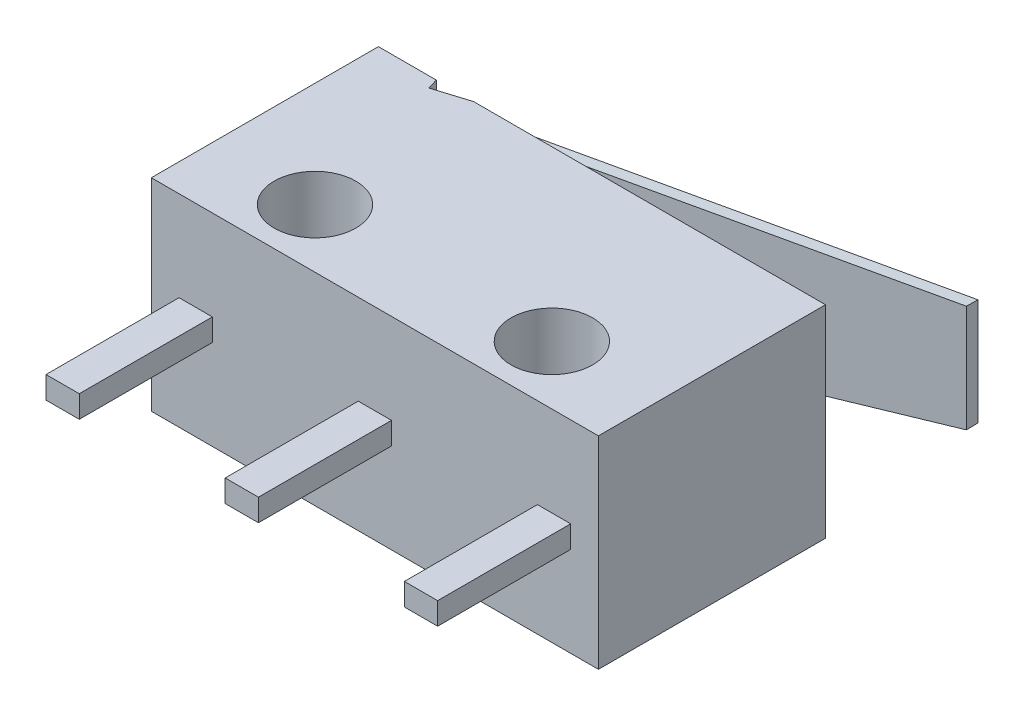
from build123d import *

# Parameters (mm, degrees)
SKETCH1_W           = 12.8016
SKETCH1_H           = 6.5024
SKETCH1_R           = 1.1684
BOSS_EXTRUDE1_DEPTH = 5.7912
SKETCH2_W           = 1.016
SKETCH2_H           = 3.556
BOSS_EXTRUDE2_DEPTH = 1.27
CUT_EXTRUDE1_DEPTH  = 4.318
BOSS_EXTRUDE6_DEPTH = 5.7912
CUT_EXTRUDE2_DEPTH  = 0.3175
SKETCH7_W           = 0.9525
SKETCH7_H           = 0.635
BOSS_EXTRUDE7_DEPTH = 3.81


with BuildPart() as part:
    # Sketch1 → Boss-Extrude1 (new body)
    with BuildSketch(Plane(origin=(0, 0, 0), x_dir=(1, 0, 0), z_dir=(0, 1, 0))):
        Rectangle(SKETCH1_W, SKETCH1_H)
        with Locations(Location((3.3909, -1.5748, 0), (0, 0, 270))):
            Circle(SKETCH1_R, mode=Mode.SUBTRACT)
        with Locations(Location((-3.3909, -1.5748, 0), (0, 0, 90))):
            Circle(SKETCH1_R, mode=Mode.SUBTRACT)
    extrude(amount=BOSS_EXTRUDE1_DEPTH)

    # Sketch2 → Boss-Extrude2 (add)
    with BuildSketch(Plane(origin=(0, 0, -3.2512), x_dir=(-1, 0, 0), z_dir=(0, 0, -1))):
        with Locations((1.9558, 2.8956)):
            Rectangle(SKETCH2_W, SKETCH2_H)
    extrude(amount=BOSS_EXTRUDE2_DEPTH)

    # Sketch3 → Cut-Extrude1 (cut)
    with BuildSketch(Plane.XZ.offset(-1.1176)):
        with BuildLine():
            Line((-1.4478, -3.2512), (-1.4478, -4.5212))
            Line((-1.4478, -4.5212), (-2.4638, -4.5212))
            Line((-2.4638, -4.5212), (-2.4638, -3.2512))
            ThreePointArc((-2.4638, -3.2512), (-1.9558, -3.7592), (-1.4478, -3.2512))
        make_face()
    extrude(amount=-CUT_EXTRUDE1_DEPTH, mode=Mode.SUBTRACT)

    # Sketch4 → Boss-Extrude6 (add)
    with BuildSketch(Plane(origin=(0, 5.7912, 0), x_dir=(1, 0, 0), z_dir=(0, 1, 0))):
        Polygon((-3.673412994, 3.2512), (-4.744089172, 3.2512), (7.092310828, 6.926499891), (7.092310828, 6.594046101), align=None)
    extrude(amount=-BOSS_EXTRUDE6_DEPTH)

    # Sketch6 → Cut-Extrude2 (cut)
    with BuildSketch(Plane(origin=(-1.337930501, 0, -4.30884038), x_dir=(-0.9550199444571864, 0, 0.29654157497557215), z_dir=(-0.29654157497557215, 0, -0.9550199444571864))):
        Polygon((3.566583809, 0.512911728), (-8.82729348, 1.368515991), (-8.82729348, 0), (3.566583809, 0), align=None)
        with BuildLine():
            Line((3.566583809, 1.689384201), (-0.891541508, 2.163353626))
            ThreePointArc((-0.891541508, 2.163353626), (-1.550065164, 2.8956), (-0.891541508, 3.627846374))
            Line((-0.891541508, 3.627846374), (3.566583809, 4.101815799))
            Line((3.566583809, 4.101815799), (3.566583809, 1.689384201))
        make_face()
        Polygon((3.566583809, 5.278288272), (3.566583809, 5.7912), (-8.82729348, 5.7912), (-8.82729348, 4.422684009), align=None)
    extrude(amount=-CUT_EXTRUDE2_DEPTH, mode=Mode.SUBTRACT)

    # Sketch7 → Boss-Extrude7 (add)
    with BuildSketch(Plane.XY.offset(3.2512)):
        with Locations((-5.1308, 2.8956)):
            Rectangle(SKETCH7_W, SKETCH7_H)
        with Locations((0, 2.8956)):
            Rectangle(SKETCH7_W, SKETCH7_H)
        with Locations((5.1308, 2.8956)):
            Rectangle(SKETCH7_W, SKETCH7_H)
    extrude(amount=BOSS_EXTRUDE7_DEPTH)


solid = part.part
